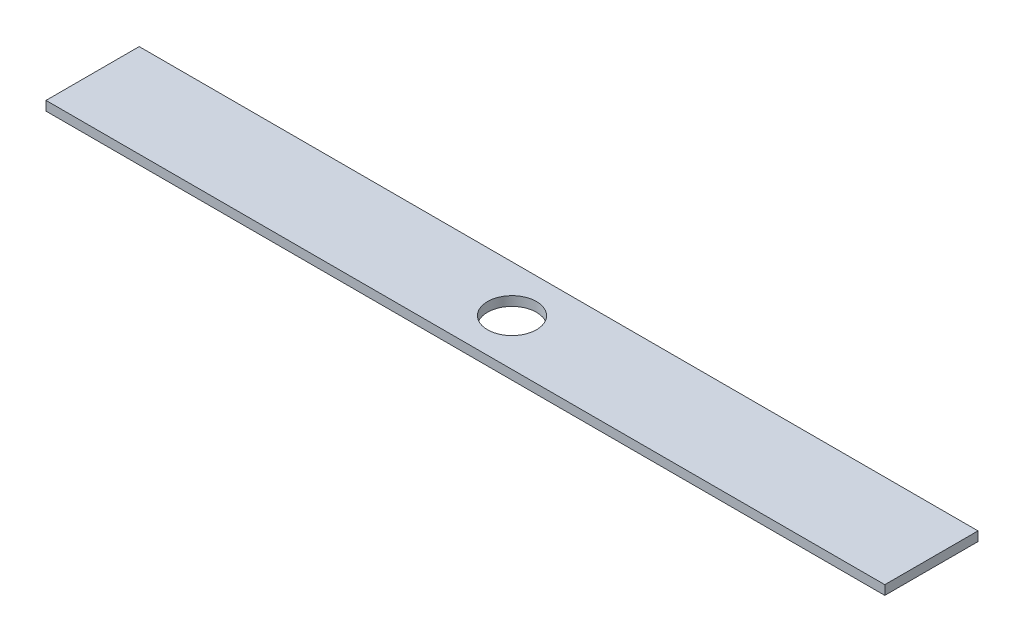
from build123d import *

# Parameters (mm, degrees)
SKETCH1_W           = 180
SKETCH1_H           = 20
SKETCH1_R           = 5.25
BOSS_EXTRUDE1_DEPTH = 1


with BuildPart() as part:
    # Sketch1 → Boss-Extrude1 (new, symmetric)
    with BuildSketch(Plane(origin=(0, 0, 0), x_dir=(1, 0, 0), z_dir=(0, 1, 0))):
        Rectangle(SKETCH1_W, SKETCH1_H)
        with Locations(Location((0, 0, 0), (0, 0, 270))):
            Circle(SKETCH1_R, mode=Mode.SUBTRACT)
    extrude(amount=BOSS_EXTRUDE1_DEPTH, both=True)


solid = part.part
